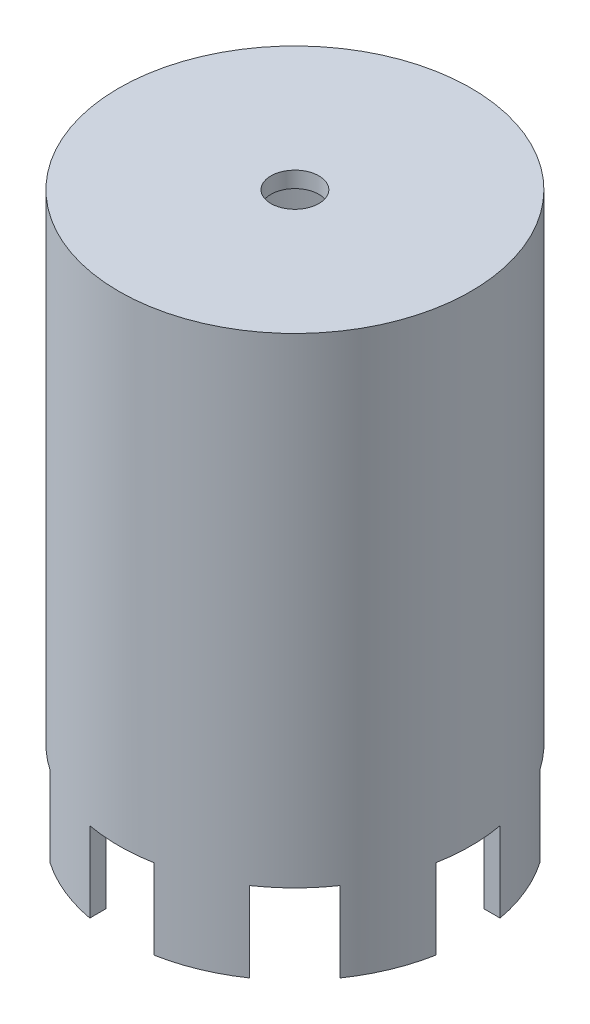
from build123d import *

# Parameters (mm, degrees)
SKETCH1_R           = 11
BOSS_EXTRUDE1_DEPTH = 35
SHELL1_T            = -1
SKETCH4_W           = 4
SKETCH4_H           = 5
CUT_EXTRUDE1_DEPTH  = 56.018178814
CIRPATTERN1_COUNT   = 8
CUT_EXTRUDE2_REACH  = 40.301
SKETCH5_R           = 1.5


with BuildPart() as part:
    # Sketch1 → Boss-Extrude1 (new body)
    with BuildSketch(Plane(origin=(0, 0, 0), x_dir=(1, 0, 0), z_dir=(0, 1, 0))):
        with Locations(Location((0, 0, 0), (0, 0, 270))):
            Circle(SKETCH1_R)
    extrude(amount=BOSS_EXTRUDE1_DEPTH)

    # Shell1
    shell1_openings = [part.faces().sort_by_distance(p)[0] for p in [
        (0, 0, 0),
    ]]
    offset(amount=SHELL1_T, openings=shell1_openings, kind=Kind.INTERSECTION)

    # Sketch4 → Cut-Extrude1 (cut, symmetric)
    with BuildSketch(Plane(origin=(30, 0, 0), x_dir=(0, 0, -1), z_dir=(1, 0, 0))):
        with Locations((0, 2.5)):
            Rectangle(SKETCH4_W, SKETCH4_H)
    cut_extrude1 = extrude(amount=CUT_EXTRUDE1_DEPTH, both=True, mode=Mode.SUBTRACT)

    # CirPattern1: Cut-Extrude1 ×8 about axis
    cirpattern1_axis = Axis((0, 0, 0), (0, 1, 0))
    for i in range(1, CIRPATTERN1_COUNT):
        add(cut_extrude1.rotate(cirpattern1_axis, i * 360 / CIRPATTERN1_COUNT), mode=Mode.SUBTRACT)

    # Sketch5 → Cut-Extrude2 (cut, up to next)
    with BuildSketch(Plane(origin=(0, 35, 0), x_dir=(1, 0, 0), z_dir=(0, 1, 0)), mode=Mode.PRIVATE) as cut_extrude2_sk1:
        with Locations(Location((0, 0, 0), (0, 0, 270))):
            Circle(SKETCH5_R)
    cut_extrude2_tool1 = extrude(cut_extrude2_sk1.sketch, amount=-CUT_EXTRUDE2_REACH, mode=Mode.PRIVATE) & part.part
    add(cut_extrude2_tool1.solids().sort_by_distance((0, 35, 0))[0], mode=Mode.SUBTRACT)


solid = part.part
